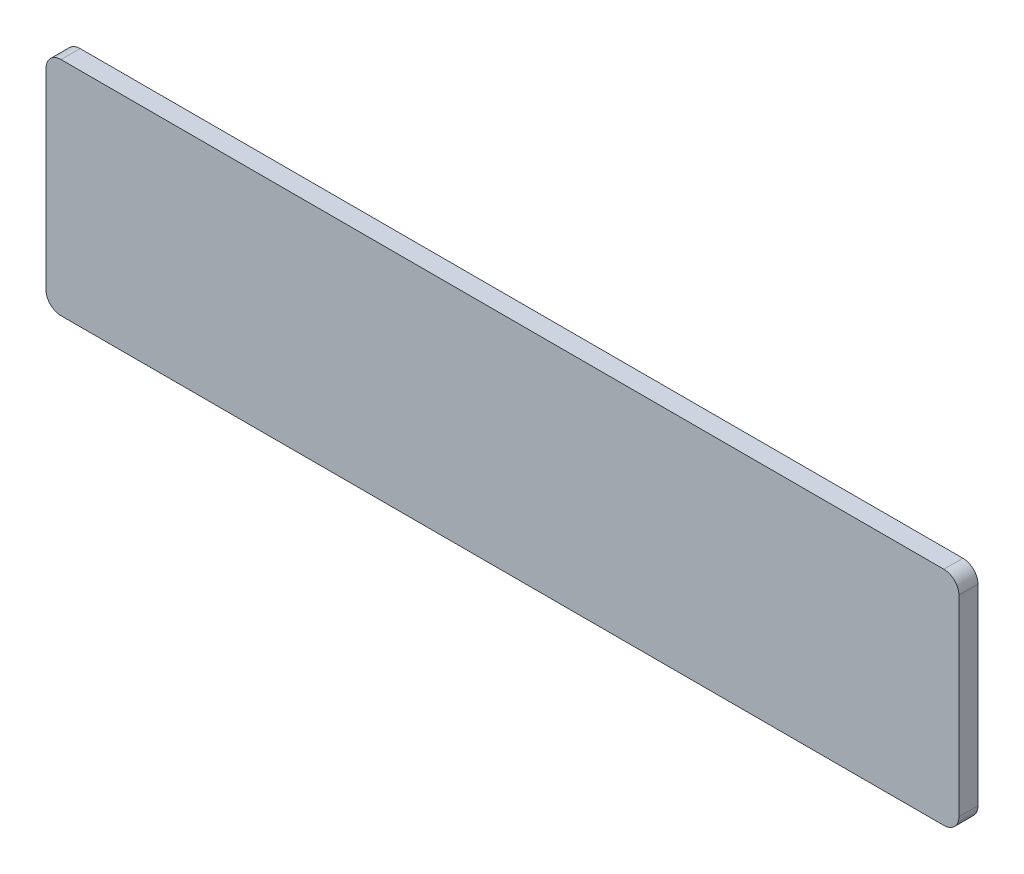
from build123d import *

# Parameters (mm, degrees)
SKETCH2_W           = 607.57
SKETCH2_H           = 147.67
BOSS_EXTRUDE1_DEPTH = 12.7
FILLET1_R           = 10


with BuildPart() as part:
    # Sketch2 → Boss-Extrude1 (new body)
    with BuildSketch(Plane.XY):
        with Locations((-303.785, 73.835)):
            Rectangle(SKETCH2_W, SKETCH2_H)
    extrude(amount=BOSS_EXTRUDE1_DEPTH)

    # Fillet1
    fillet1_edges = [part.edges().sort_by_distance(p)[0] for p in [
        (0, 0, 6.35),
        (-607.57, 0, 6.35),
        (-607.57, 147.67, 6.35),
        (0, 147.67, 6.35),
    ]]
    fillet(fillet1_edges, radius=FILLET1_R)


solid = part.part
